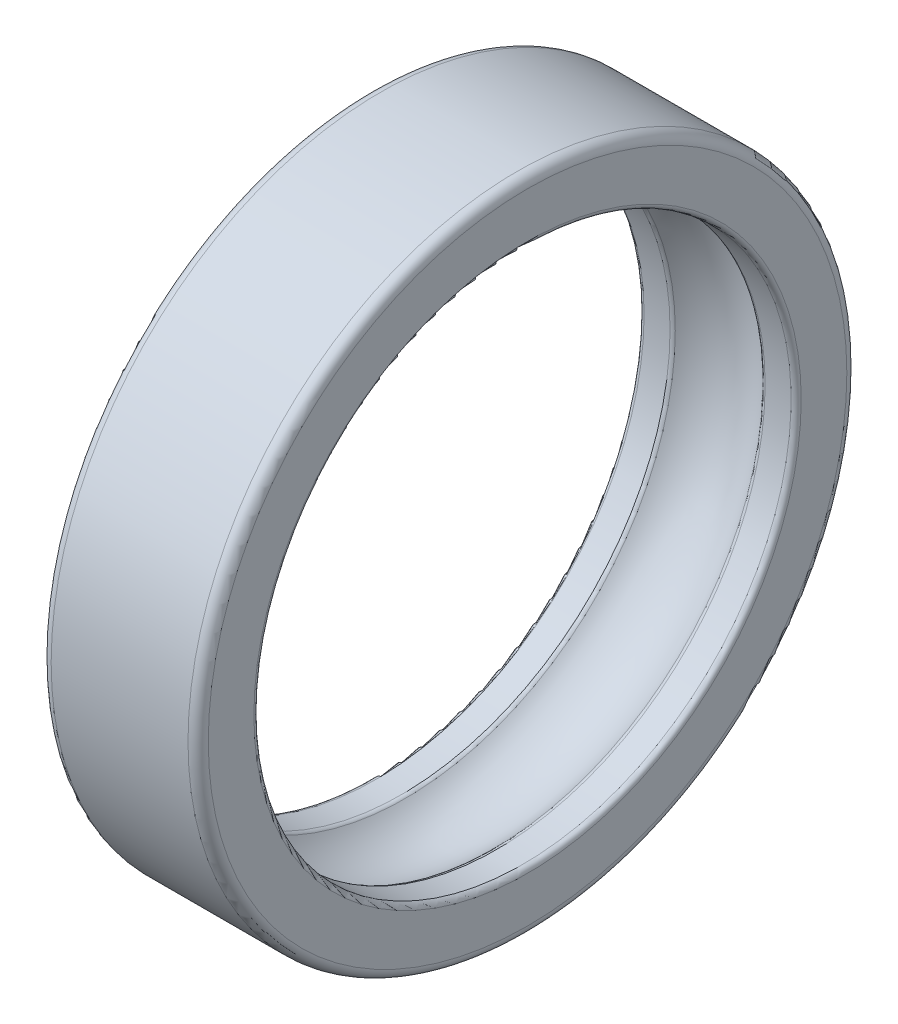
from build123d import *

# Parameters (mm, degrees)
FILLET1_R = 1


with BuildPart() as part:
    # Sketch1 → Revolve1 (revolve)
    with BuildSketch(Plane.XY, mode=Mode.PRIVATE) as revolve1_sk:
        with BuildLine():
            Line((8.94427191, 53), (15.5, 53))
            Line((15.5, 53), (15.5, 63))
            ThreePointArc((15.5, 63), (14.914213562, 64.414213562), (13.5, 65))
            Line((13.5, 65), (-13.5, 65))
            ThreePointArc((-13.5, 65), (-14.914213562, 64.414213562), (-15.5, 63))
            Line((-15.5, 63), (-15.5, 53))
            Line((-15.5, 53), (-8.94427191, 53))
            ThreePointArc((-8.94427191, 53), (0, 57), (8.94427191, 53))
        make_face()
    revolve(revolve1_sk.sketch.rotate(Axis((0, 0, 0), (1, 0, 0)), 90), axis=Axis((0, 0, 0), (1, 0, 0)))

    # Fillet1
    fillet1_edges = [part.edges().sort_by_distance(p)[0] for p in [
        (15.5, 0, -53),
        (8.94427191, 0, -53),
        (-8.94427191, 0, -53),
        (-15.5, 0, -53),
    ]]
    fillet(fillet1_edges, radius=FILLET1_R)


solid = part.part
